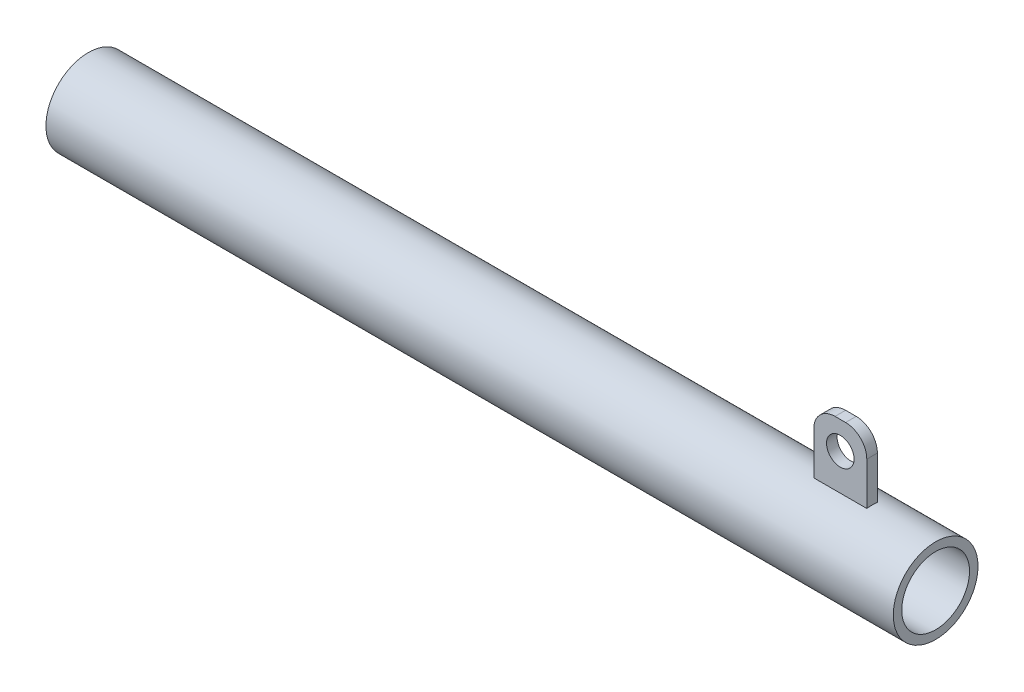
from build123d import *

# Parameters (mm, degrees)
SKETCH1_R                = 20
SKETCH1_R_2              = 16
BOSS_EXTRUDE1_DEPTH      = 400
BOSS_EXTRUDE2_REACH      = 408.571
BOSS_EXTRUDE2_END_RADIUS = 20
SKETCH2_W                = 25
SKETCH2_H                = 5
FILLET1_R                = 10
SKETCH3_R                = 6.5
CUT_EXTRUDE1_DEPTH       = 10


with BuildPart() as part:
    # Sketch1 → Boss-Extrude1 (new body)
    with BuildSketch(Plane(origin=(0, 0, 0), x_dir=(0, 0, -1), z_dir=(1, 0, 0))):
        Circle(SKETCH1_R)
        Circle(SKETCH1_R_2, mode=Mode.SUBTRACT)
    extrude(amount=-BOSS_EXTRUDE1_DEPTH)

    # Boss-Extrude2: up to this cylinder (the profile starts outside it)
    boss_extrude2_end = Plane(origin=(-42.5, 0, 0), z_dir=(1, 0, 0)) * Cylinder(BOSS_EXTRUDE2_END_RADIUS, 858.142, mode=Mode.PRIVATE)
    # Sketch2 → Boss-Extrude2 (add, up to the surface)
    with BuildSketch(Plane(origin=(0, 50, 0), x_dir=(1, 0, 0), z_dir=(0, 1, 0)), mode=Mode.PRIVATE) as boss_extrude2_sk1:
        with Locations((-42.5, 0)):
            Rectangle(SKETCH2_W, SKETCH2_H)
    boss_extrude2_tool1 = extrude(boss_extrude2_sk1.sketch, amount=-BOSS_EXTRUDE2_REACH, mode=Mode.PRIVATE) - boss_extrude2_end
    add(boss_extrude2_tool1.solids().sort_by_distance((-42.5, 50, 0))[0])

    # Fillet1
    fillet1_edges = [part.edges().sort_by_distance(p)[0] for p in [
        (-30, 50, 0),
        (-55, 50, 0),
    ]]
    fillet(fillet1_edges, radius=FILLET1_R)

    # Sketch3 → Cut-Extrude1 (cut)
    with BuildSketch(Plane.XY.offset(2.5)):
        with Locations((-42.5, 37)):
            Circle(SKETCH3_R)
    extrude(amount=-CUT_EXTRUDE1_DEPTH, mode=Mode.SUBTRACT)


solid = part.part
